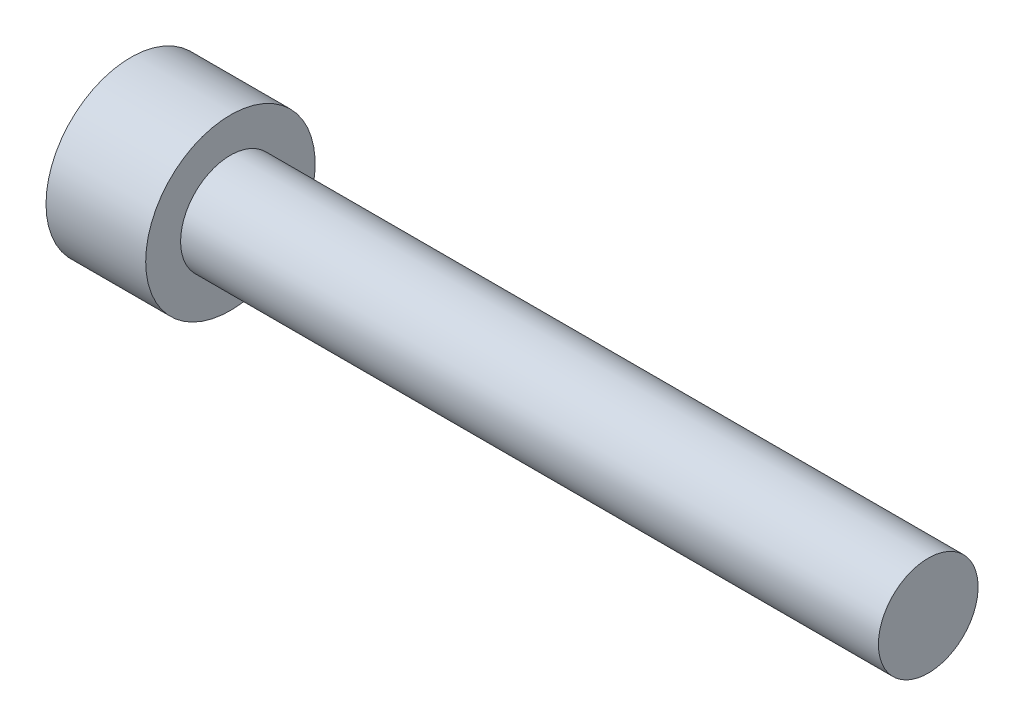
from build123d import *

# Parameters (mm, degrees)
SOCKET_DEPTH = 2.5


with BuildPart() as part:
    # Screw Sketch → Screw (revolve)
    with BuildSketch(Plane.XY):
        Polygon((-5, 0), (-5, 4.25), (0, 4.25), (0, 2.5), (35, 2.5), (35, 0), align=None)
    revolve(axis=Axis((-1000, 0, 0), (1, 0, 0)))

    # Socket Sketch → Socket (cut)
    with BuildSketch(Plane(origin=(-5, 0, 0), x_dir=(0, 0, -1), z_dir=(1, 0, 0))):
        Polygon((2.309401077, 0), (1.154700538, 2), (-1.154700538, 2), (-2.309401077, 0), (-1.154700538, -2), (1.154700538, -2), align=None)
    extrude(amount=SOCKET_DEPTH, mode=Mode.SUBTRACT)


solid = part.part
